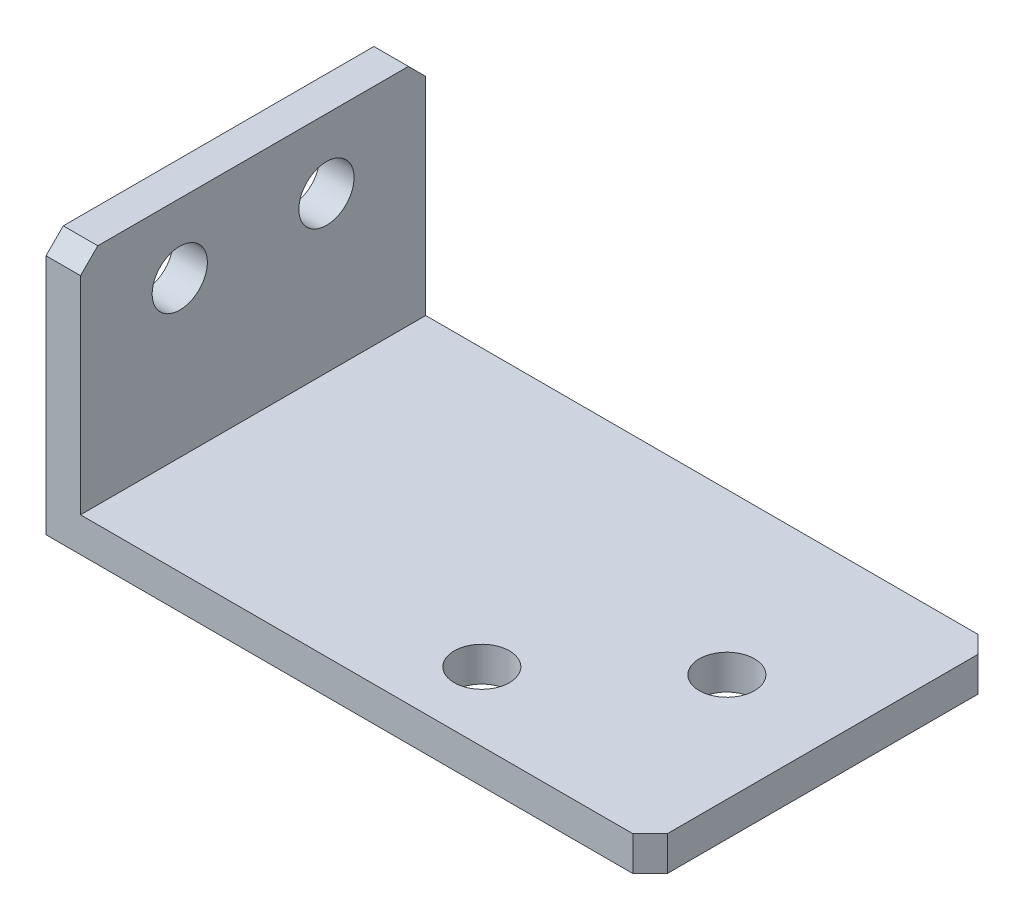
from build123d import *

# Parameters (mm, degrees)
BASE_DEPTH                 = 20
CHAMFER1_SIZE              = 1
F_3_2_3_2_MOUNTSIDE_D      = 3.2
F_3_2_3_2_CABLECHAINSIDE_D = 3.2


with BuildPart() as part:
    # Sketch1 → Base (new body)
    with BuildSketch(Plane.XY):
        Polygon((0, 0), (35, 0), (35, 2), (2, 2), (2, 15), (0, 15), align=None)
    extrude(amount=BASE_DEPTH)

    # Chamfer1
    chamfer1_edges = [part.edges().sort_by_distance(p)[0] for p in [
        (35, 1, 20),
        (1, 15, 20),
        (1, 15, 0),
        (35, 1, 0),
    ]]
    chamfer(chamfer1_edges, length=CHAMFER1_SIZE)

    # Ø3.2 (3.2) MountSide (through all)
    with Locations(Plane.ZY):
        with Locations((5.75, 11), (14.25, 11)):
            Hole(F_3_2_3_2_MOUNTSIDE_D / 2)

    # Ø3.2 (3.2) CableChainSide (through all)
    with Locations(Plane(origin=(0, 0, 0), x_dir=(-1, 0, 0), z_dir=(0, -1, 0))):
        with Locations((-28.75, -9.3), (-21.25, -16)):
            Hole(F_3_2_3_2_CABLECHAINSIDE_D / 2)


solid = part.part
